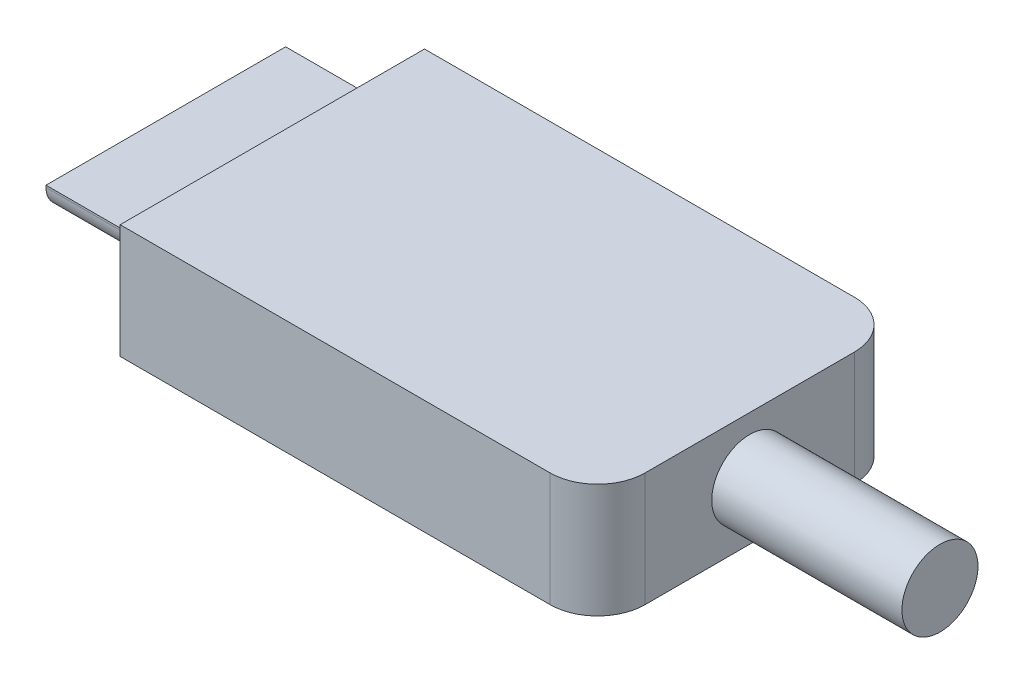
from build123d import *

# Parameters (mm, degrees)
BOSS_EXTRUDE1_DEPTH      = 3
BOSS_EXTRUDE1_DEPTH_BACK = 3
BOSS_EXTRUDE2_DEPTH      = 5.6
SKETCH3_R                = 2
BOSS_EXTRUDE3_DEPTH      = 10


with BuildPart() as part:
    # Sketch1 → Boss-Extrude1 (new, two sides: drawn at the far end of the back side and taken through both)
    with BuildSketch(Plane(origin=(0, 0, 0), x_dir=(1, 0, 0), z_dir=(0, 1, 0)).offset(-BOSS_EXTRUDE1_DEPTH_BACK)):
        with BuildLine():
            Line((-12.55, 8), (10.05, 8))
            ThreePointArc((10.05, 8), (11.817766953, 7.267766953), (12.55, 5.5))
            Line((12.55, 5.5), (12.55, -5.5))
            ThreePointArc((12.55, -5.5), (11.817766953, -7.267766953), (10.05, -8))
            Line((10.05, -8), (-12.55, -8))
            Line((-12.55, -8), (-12.55, 8))
        make_face()
    extrude(amount=BOSS_EXTRUDE1_DEPTH + BOSS_EXTRUDE1_DEPTH_BACK)

    # Sketch2 → Boss-Extrude2 (add)
    with BuildSketch(Plane.ZY.offset(12.55)):
        with BuildLine():
            Line((6.3, 1.044645313), (6.3, 1.15))
            Line((6.3, 1.15), (-6.3, 1.15))
            Line((-6.3, 1.15), (-6.3, -1.15))
            Line((-6.3, -1.15), (-2, -1.15))
            Line((-2, -1.15), (-2, -0.605330086))
            ThreePointArc((-2, -0.605330086), (-1.52157966, 0.110676552), (-0.676992245, -0.05732233))
            Line((-0.676992245, -0.05732233), (0.064213562, -0.798528137))
            ThreePointArc((0.064213562, -0.798528137), (0.453521581, -1.058655439), (0.9127417, -1.15))
            Line((0.9127417, -1.15), (4.105354687, -1.15))
            ThreePointArc((4.105354687, -1.15), (4.564574806, -1.058655439), (4.953882825, -0.798528137))
            Line((4.953882825, -0.798528137), (5.948528137, 0.196117175))
            ThreePointArc((5.948528137, 0.196117175), (6.208655439, 0.585425194), (6.3, 1.044645313))
        make_face()
        with BuildLine():
            Line((4.812461468, -0.657106781), (5.807106781, 0.337538532))
            ThreePointArc((5.807106781, 0.337538532), (6.004712185, 0.618622002), (6.095511057, 0.95))
            Line((6.095511057, 0.95), (-6.1, 0.95))
            Line((-6.1, 0.95), (-6.1, -0.95))
            Line((-6.1, -0.95), (-2.2, -0.95))
            Line((-2.2, -0.95), (-2.2, -0.605330086))
            ThreePointArc((-2.2, -0.605330086), (-1.598116347, 0.295452458), (-0.535570888, 0.084099026))
            Line((-0.535570888, 0.084099026), (0.205634919, -0.657106781))
            ThreePointArc((0.205634919, -0.657106781), (0.530058267, -0.873879533), (0.9127417, -0.95))
            Line((0.9127417, -0.95), (4.105354687, -0.95))
            ThreePointArc((4.105354687, -0.95), (4.48803812, -0.873879533), (4.812461468, -0.657106781))
        make_face(mode=Mode.SUBTRACT)
    extrude(amount=BOSS_EXTRUDE2_DEPTH)

    # Sketch3 → Boss-Extrude3 (add)
    with BuildSketch(Plane(origin=(12.55, 0, 0), x_dir=(0, 0, -1), z_dir=(1, 0, 0))):
        Circle(SKETCH3_R)
    extrude(amount=BOSS_EXTRUDE3_DEPTH)


solid = part.part
